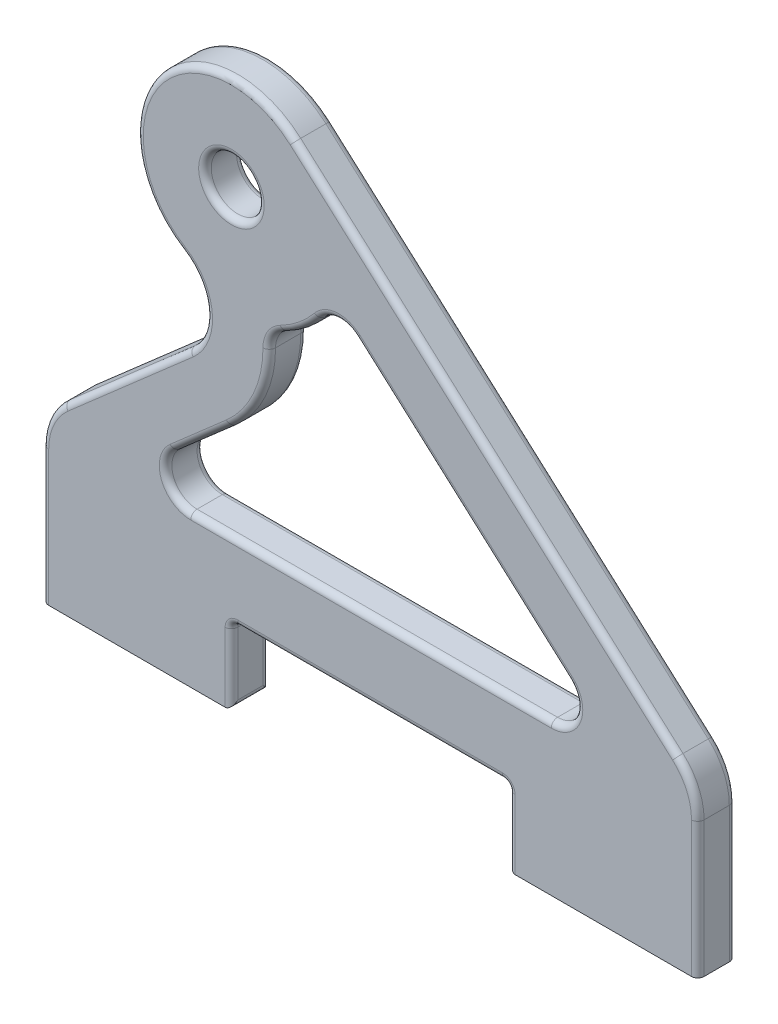
from build123d import *

# Parameters (mm, degrees)
SKETCH1_R           = 2.1
BOSS_EXTRUDE1_DEPTH = 3
FILLET1_R           = 5
CUT_EXTRUDE1_DEPTH  = 10
FILLET2_R           = 0.5


with BuildPart() as part:
    # Sketch1 → Boss-Extrude1 (new body)
    with BuildSketch(Plane.XY):
        with BuildLine():
            Line((0, 0), (15, 0))
            Line((15, 0), (15, 6))
            Line((15, 6), (37, 6))
            Line((37, 6), (37, 0))
            Line((37, 0), (52, 0))
            Line((52, 0), (52, 13))
            Line((52, 13), (19.996940762, 41.592904704))
            ThreePointArc((19.996940762, 41.592904704), (8.979959751, 40.473154971), (11.086956522, 29.60171189))
            ThreePointArc((11.086956522, 29.60171189), (12.985575047, 26.528690369), (11.63390392, 23.178884593))
            Line((11.63390392, 23.178884593), (0, 13))
            Line((0, 13), (0, 0))
        make_face()
        with Locations((15, 36)):
            Circle(SKETCH1_R, mode=Mode.SUBTRACT)
    extrude(amount=BOSS_EXTRUDE1_DEPTH)

    # Fillet1
    fillet1_edges = [part.edges().sort_by_distance(p)[0] for p in [
        (0, 13, 1.5),
        (52, 13, 1.5),
    ]]
    fillet(fillet1_edges, radius=FILLET1_R)

    # Sketch3 → Cut-Extrude1 (cut)
    with BuildSketch(Plane(origin=(0, 0, 0), x_dir=(-1, 0, 0), z_dir=(0, 0, -1))):
        with BuildLine():
            Line((-41.706823442, 15.491441254), (-24.86009534, 30.543030154))
            ThreePointArc((-24.86009534, 30.543030154), (-23.369836338, 31.045358604), (-21.977109112, 30.314936373))
            ThreePointArc((-21.977109112, 30.314936373), (-20.655452205, 28.998867209), (-19.090903049, 27.983485031))
            ThreePointArc((-19.090903049, 27.983485031), (-18.293782453, 27.245515521), (-17.999993958, 26.199719861))
            ThreePointArc((-17.999993958, 26.199719861), (-17.197778778, 22.474937905), (-14.926283821, 19.415875878))
            Line((-14.926283821, 19.415875878), (-10.456600876, 15.505203486))
            ThreePointArc((-10.456600876, 15.505203486), (-9.901333969, 13.296582262), (-11.773552836, 12))
            Line((-11.773552836, 12), (-40.374305906, 12))
            ThreePointArc((-40.374305906, 12), (-42.242845778, 13.286866951), (-41.706823442, 15.491441254))
        make_face()
    extrude(amount=-CUT_EXTRUDE1_DEPTH, mode=Mode.SUBTRACT)

    # Fillet2
    fillet2_edges = [part.edges().sort_by_distance(p)[0] for p in [
        (15, 3, 3),
        (6.67076201, 18.836468748, 0),
        (12.985575047, 26.528690369, 0),
        (8.979959751, 40.473154971, 0),
        (52, 5.381145232, 0),
        (37, 3, 0),
        (26, 6, 0),
        (26, 6, 3),
        (15, 3, 0),
        (37, 3, 3),
        (37, 0, 1.5),
        (37, 6, 1.5),
        (15, 6, 1.5),
        (15, 0, 1.5),
        (52, 5.381145232, 3),
        (12.9, 36, 0),
        (12.9, 36, 3),
        (8.979959751, 40.473154971, 3),
        (12.985575047, 26.528690369, 3),
        (6.67076201, 18.836468748, 3),
        (35.164117301, 28.041899151, 0),
        (35.164117301, 28.041899151, 3),
        (0, 5.365522094, 0),
        (0.446874727, 12.797212198, 0),
        (51.563796074, 12.804780463, 0),
        (0, 5.365522094, 3),
        (0.446874727, 12.797212198, 3),
        (51.563796074, 12.804780463, 3),
        (17.197778778, 22.474937905, 3),
        (12.691442348, 17.460539682, 3),
        (9.901333969, 13.296582262, 3),
        (26.073929371, 12, 3),
        (42.242845778, 13.286866951, 3),
        (33.283459391, 23.017235704, 3),
        (23.369836338, 31.045358604, 3),
        (20.655452205, 28.998867209, 3),
        (18.293782453, 27.245515521, 3),
        (17.197778778, 22.474937905, 0),
        (18.293782453, 27.245515521, 0),
        (20.655452205, 28.998867209, 0),
        (23.369836338, 31.045358604, 0),
        (33.283459391, 23.017235704, 0),
        (42.242845778, 13.286866951, 0),
        (26.073929371, 12, 0),
        (9.901333969, 13.296582262, 0),
        (12.691442348, 17.460539682, 0),
    ]]
    fillet(fillet2_edges, radius=FILLET2_R)


solid = part.part
